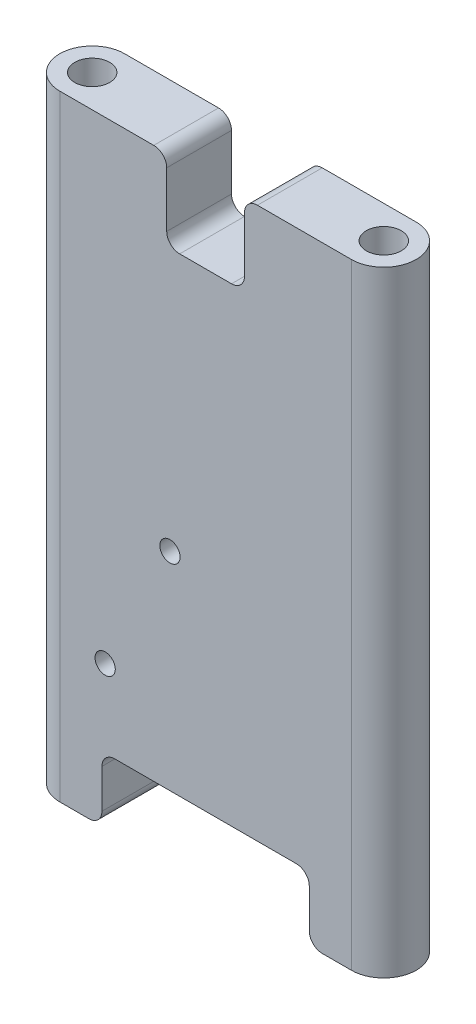
from build123d import *

# Parameters (mm, degrees)
SKETCH1_R               = 3.429
BOSS_EXTRUDE1_DEPTH     = 60.325
CUT_EXTRUDE1_DEPTH      = 70.9941694
CUT_EXTRUDE1_DEPTH_BACK = 70.9941694
FILLET1_R               = 2.54
CUT_EXTRUDE3_DEPTH      = 71.853025694
CUT_EXTRUDE3_DEPTH_BACK = 71.853025694
SKETCH5_W               = 40.64
SKETCH5_H               = 12.7
FILLET2_R               = 2.54
SKETCH4_R               = 1.984375
CUT_EXTRUDE2_DEPTH      = 6.35
SKETCH6_R               = 1.984375
CUT_EXTRUDE4_DEPTH      = 6.35
SKETCH7_R               = 1.984375
CUT_EXTRUDE5_DEPTH      = 6.35


with BuildPart() as part:
    # Sketch1 → Boss-Extrude1 (new, symmetric)
    with BuildSketch(Plane(origin=(0, 0, 0), x_dir=(1, 0, 0), z_dir=(0, 1, 0))):
        with BuildLine():
            Line((-28.575, 6.35), (28.575, 6.35))
            ThreePointArc((28.575, 6.35), (34.925, 0), (28.575, -6.35))
            Line((28.575, -6.35), (-28.575, -6.35))
            ThreePointArc((-28.575, -6.35), (-34.925, 0), (-28.575, 6.35))
        make_face()
        with Locations(Location((28.575, 0, 0), (0, 0, 90))):
            Circle(SKETCH1_R, mode=Mode.SUBTRACT)
        with Locations(Location((-28.575, 0, 0), (0, 0, 90))):
            Circle(SKETCH1_R, mode=Mode.SUBTRACT)
    extrude(amount=BOSS_EXTRUDE1_DEPTH, both=True)

    # Sketch2 → Cut-Extrude1 (cut, two sides: drawn at the far end of the back side and taken through both)
    with BuildSketch(Plane.XY.offset(-CUT_EXTRUDE1_DEPTH_BACK)):
        Polygon((-7.62, 326.18824101), (-7.62, 60.325), (-7.62, 44.45), (7.62, 44.45), (7.62, 60.325), (7.62, 326.18824101), (7.62, 857.914723029), (-7.62, 857.914723029), align=None)
    extrude(amount=CUT_EXTRUDE1_DEPTH + CUT_EXTRUDE1_DEPTH_BACK, mode=Mode.SUBTRACT)

    # Fillet1
    fillet1_edges = [part.edges().sort_by_distance(p)[0] for p in [
        (-7.62, 44.45, 0),
        (7.62, 44.45, 0),
        (7.62, 60.325, 0),
        (-7.62, 60.325, 0),
    ]]
    fillet(fillet1_edges, radius=FILLET1_R)

    # Sketch5 → Cut-Extrude3 (cut, two sides: drawn at the far end of the back side and taken through both)
    with BuildSketch(Plane.XY.offset(6.35).offset(-CUT_EXTRUDE3_DEPTH_BACK)):
        with Locations((0, -53.975)):
            Rectangle(SKETCH5_W, SKETCH5_H)
    extrude(amount=CUT_EXTRUDE3_DEPTH + CUT_EXTRUDE3_DEPTH_BACK, mode=Mode.SUBTRACT)

    # Fillet2
    fillet2_edges = [part.edges().sort_by_distance(p)[0] for p in [
        (-20.32, -60.325, 0),
        (-20.32, -47.625, 0),
        (20.32, -47.625, 0),
        (20.32, -60.325, 0),
    ]]
    fillet(fillet2_edges, radius=FILLET2_R)

    # Sketch4 → Cut-Extrude2 (cut)
    with BuildSketch(Plane.XY.offset(6.35)):
        with Locations((-6.985, -6.985)):
            Circle(SKETCH4_R)
        with Locations((-19.685, -32.385)):
            Circle(SKETCH4_R)
    extrude(amount=-CUT_EXTRUDE2_DEPTH, mode=Mode.SUBTRACT)

    # Sketch6 → Cut-Extrude4 (cut)
    with BuildSketch(Plane(origin=(0, 0, -6.35), x_dir=(-1, 0, 0), z_dir=(0, 0, -1))):
        with Locations((5.08, 35.711069013)):
            Circle(SKETCH6_R)
        with Locations((20.955, 35.711069013)):
            Circle(SKETCH6_R)
        with Locations((5.08, -40.488930987)):
            Circle(SKETCH6_R)
        with Locations((20.955, -40.488930987)):
            Circle(SKETCH6_R)
    extrude(amount=-CUT_EXTRUDE4_DEPTH, mode=Mode.SUBTRACT)

    # Sketch7 → Cut-Extrude5 (cut)
    with BuildSketch(Plane(origin=(0, 0, -6.35), x_dir=(-1, 0, 0), z_dir=(0, 0, -1))):
        with Locations((-15.875, 15.875)):
            Circle(SKETCH7_R)
        with Locations((-15.875, -22.225)):
            Circle(SKETCH7_R)
    extrude(amount=-CUT_EXTRUDE5_DEPTH, mode=Mode.SUBTRACT)


solid = part.part
